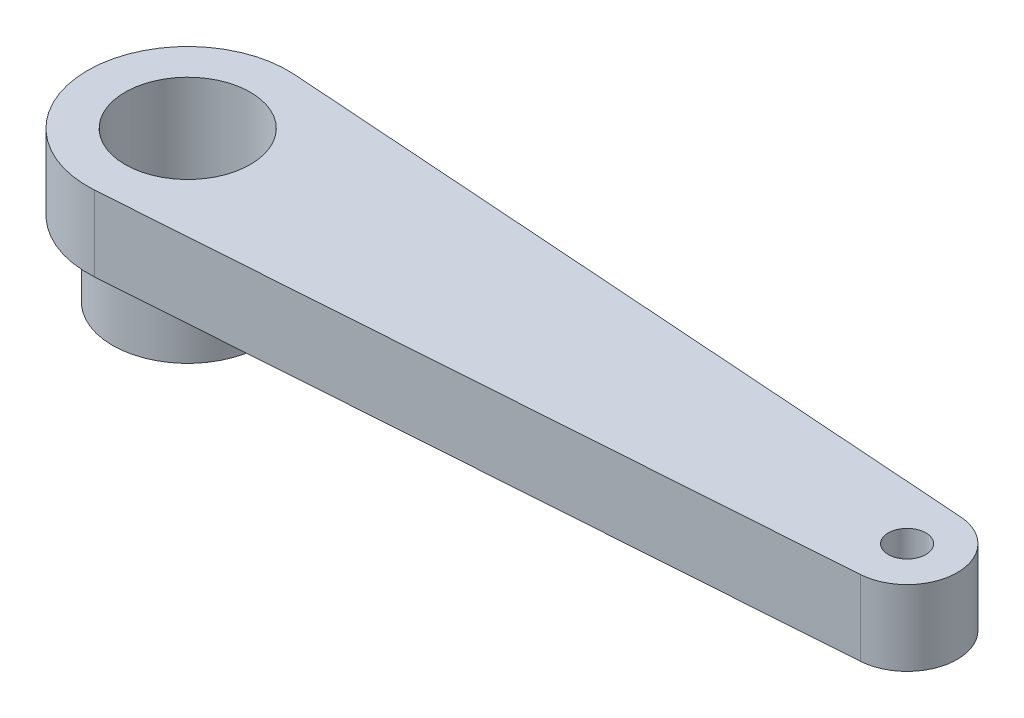
from build123d import *

# Parameters (mm, degrees)
SKETCH1_R           = 2.5
SKETCH1_R_2         = 0.75
BOSS_EXTRUDE1_DEPTH = 3
BOSS_EXTRUDE2_START = -6
SKETCH2_R           = 3
SKETCH2_R_2         = 2.5
BOSS_EXTRUDE2_DEPTH = 3


with BuildPart() as part:
    # Sketch1 → Boss-Extrude1 (new body)
    with BuildSketch(Plane(origin=(0, 0, 0), x_dir=(1, 0, 0), z_dir=(0, 1, 0))):
        with BuildLine():
            Line((0.278745645, 3.990275788), (28.839372822, 1.995137894))
            ThreePointArc((28.839372822, 1.995137894), (30.7, 0), (28.839372822, -1.995137894))
            Line((28.839372822, -1.995137894), (0.278745645, -3.990275788))
            ThreePointArc((0.278745645, -3.990275788), (-4, 0), (0.278745645, 3.990275788))
        make_face()
        with Locations(Location((0, 0, 0), (0, 0, 270))):
            Circle(SKETCH1_R, mode=Mode.SUBTRACT)
        with Locations(Location((28.7, 0, 0), (0, 0, 270))):
            Circle(SKETCH1_R_2, mode=Mode.SUBTRACT)
    extrude(amount=BOSS_EXTRUDE1_DEPTH)

    # Sketch2 → Boss-Extrude2 (add)
    with BuildSketch(Plane(origin=(0, 3, 0), x_dir=(1, 0, 0), z_dir=(0, 1, 0)).offset(BOSS_EXTRUDE2_START)):
        with Locations(Location((0, 0, 0), (0, 0, 270))):
            Circle(SKETCH2_R)
        with Locations(Location((0, 0, 0), (0, 0, 270))):
            Circle(SKETCH2_R_2, mode=Mode.SUBTRACT)
    extrude(amount=BOSS_EXTRUDE2_DEPTH)


solid = part.part
